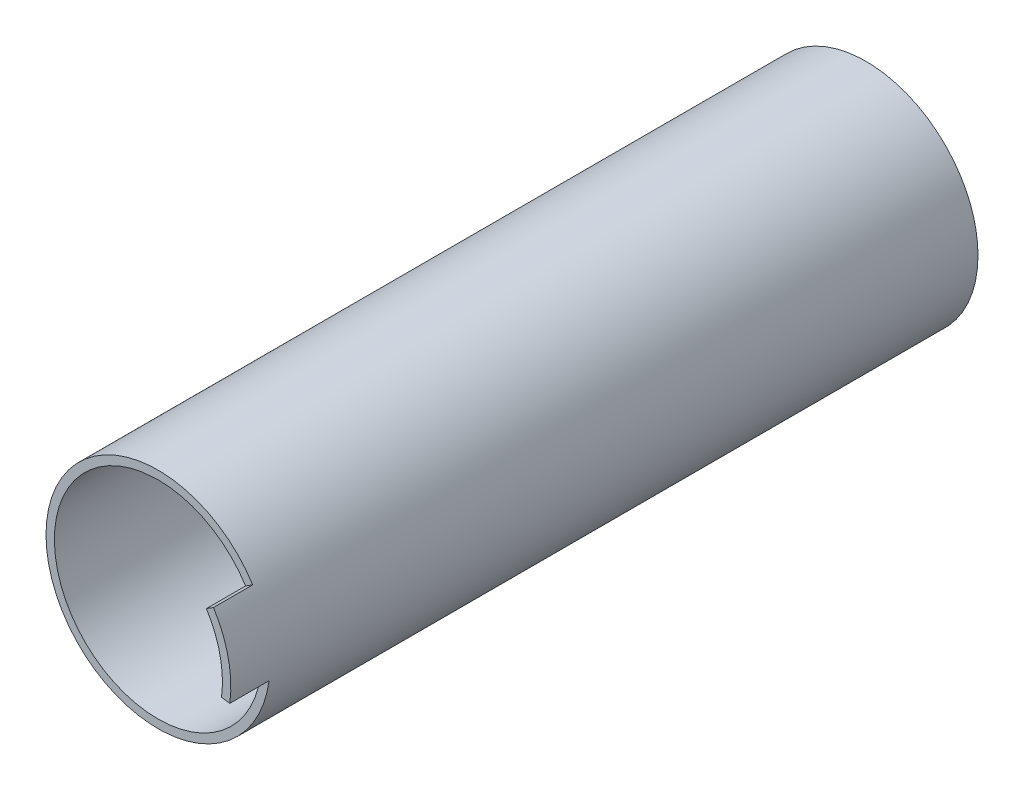
from build123d import *

# Parameters (mm, degrees)
SKETCH_2_R          = 20
SKETCH_2_R_2        = 18.5
EXTRUDE_1_DEPTH     = 126.4
SKETCH_5_R          = 3
EXTRUDE_3_DEPTH     = 126.4
CUT_EXTRUDE1_DEPTH  = 59
CUT_EXTRUDE2_DEPTH  = 59
BOSS_EXTRUDE4_DEPTH = 7
SKETCH3_R           = 3
BOSS_EXTRUDE6_DEPTH = 58.6


with BuildPart() as part:
    # Эскиз2 → Бобышка-Вытянуть1 (new body)
    with BuildSketch(Plane.XY):
        Circle(SKETCH_2_R)
        Circle(SKETCH_2_R_2, mode=Mode.SUBTRACT)
    extrude(amount=EXTRUDE_1_DEPTH)

    # Эскиз5 → Бобышка-Вытянуть3 (add, through all)
    with BuildSketch(Plane(origin=(0, 0, 0), x_dir=(-1, 0, 0), z_dir=(0, 0, -1))):
        with BuildLine():
            Line((0, 18.5), (0, 9.219544457))
            ThreePointArc((0, 9.219544457), (-0.725705562, 6.35915669), (-2.727272727, 4.190702026))
            ThreePointArc((-2.727272727, 4.190702026), (-0.405405405, -4.983537544), (3.368749585, 3.694797184))
            ThreePointArc((3.368749585, 3.694797184), (1.743983113, 6.158250179), (1.490138787, 9.098323274))
            Line((1.490138787, 9.098323274), (2.990122527, 18.256756757))
            ThreePointArc((2.990122527, 18.256756757), (1.5, 18.439088915), (0, 18.5))
        make_face()
        Circle(SKETCH_5_R, mode=Mode.SUBTRACT)
    extrude(amount=-EXTRUDE_3_DEPTH)

    # Sketch1 → Cut-Extrude1 (cut)
    with BuildSketch(Plane(origin=(0, 0, 0), x_dir=(-1, 0, 0), z_dir=(0, 0, -1))):
        with BuildLine():
            Line((0, 18.5), (2.990122527, 18.256756757))
            ThreePointArc((2.990122527, 18.256756757), (-1.5, -18.439088915), (0, 18.5))
        make_face()
    extrude(amount=-CUT_EXTRUDE1_DEPTH, mode=Mode.SUBTRACT)

    # Sketch2 → Cut-Extrude2 (cut)
    with BuildSketch(Plane.XY.offset(126.4)):
        with BuildLine():
            Line((0, 18.5), (-2.990122527, 18.256756757))
            ThreePointArc((-2.990122527, 18.256756757), (1.50000041, -18.439093959), (0, 18.5))
        make_face()
    extrude(amount=-CUT_EXTRUDE2_DEPTH, mode=Mode.SUBTRACT)

    # Sketch6 → Boss-Extrude4 (add)
    with BuildSketch(Plane.XY.offset(126.4)):
        with BuildLine():
            Line((16.901505151, 10.692947377), (15.633892265, 9.890976324))
            ThreePointArc((15.633892265, 9.890976324), (18.073966336, 3.947371391), (18.334053323, -2.472344789))
            Line((18.334053323, -2.472344789), (19.820598187, -2.672805177))
            ThreePointArc((19.820598187, -2.672805177), (19.539423066, 4.267428531), (16.901505151, 10.692947377))
        make_face()
    extrude(amount=BOSS_EXTRUDE4_DEPTH)


with BuildPart() as body_2:
    # Sketch3 → Boss-Extrude6 (new body)
    with BuildSketch(Plane.XY):
        with BuildLine():
            Line((5, 0), (5, 16.770509831))
            ThreePointArc((5, 16.770509831), (0, 17.5), (-5, 16.770509831))
            Line((-5, 16.770509831), (-5, 0))
            ThreePointArc((-5, 0), (0, -5), (5, 0))
        make_face()
        with Locations(Location((0, 0, 0), (0, 0, 180))):
            Circle(SKETCH3_R, mode=Mode.SUBTRACT)
    extrude(amount=BOSS_EXTRUDE6_DEPTH)


solid = Compound([part.part, body_2.part])
